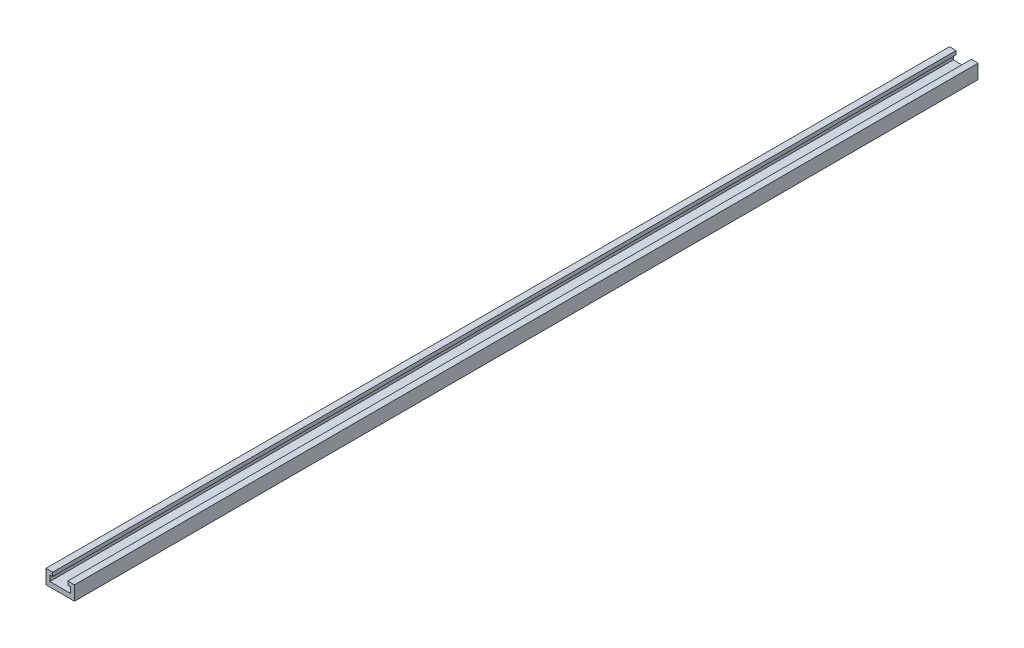
from build123d import *

# Parameters (mm, degrees)
BOSS_EXTRUDE1_DEPTH = 301.625


with BuildPart() as part:
    # Sketch2 → Boss-Extrude1 (new, symmetric)
    with BuildSketch(Plane.XY):
        Polygon((4.445, 9.525), (4.445, 6.985), (2.54, 6.985), (2.54, 3.175), (16.51, 3.175), (16.51, 6.985), (14.605, 6.985), (14.605, 9.525), (19.05, 9.525), (19.05, 0), (0, 0), (0, 9.525), align=None)
    extrude(amount=BOSS_EXTRUDE1_DEPTH, both=True)


solid = part.part
